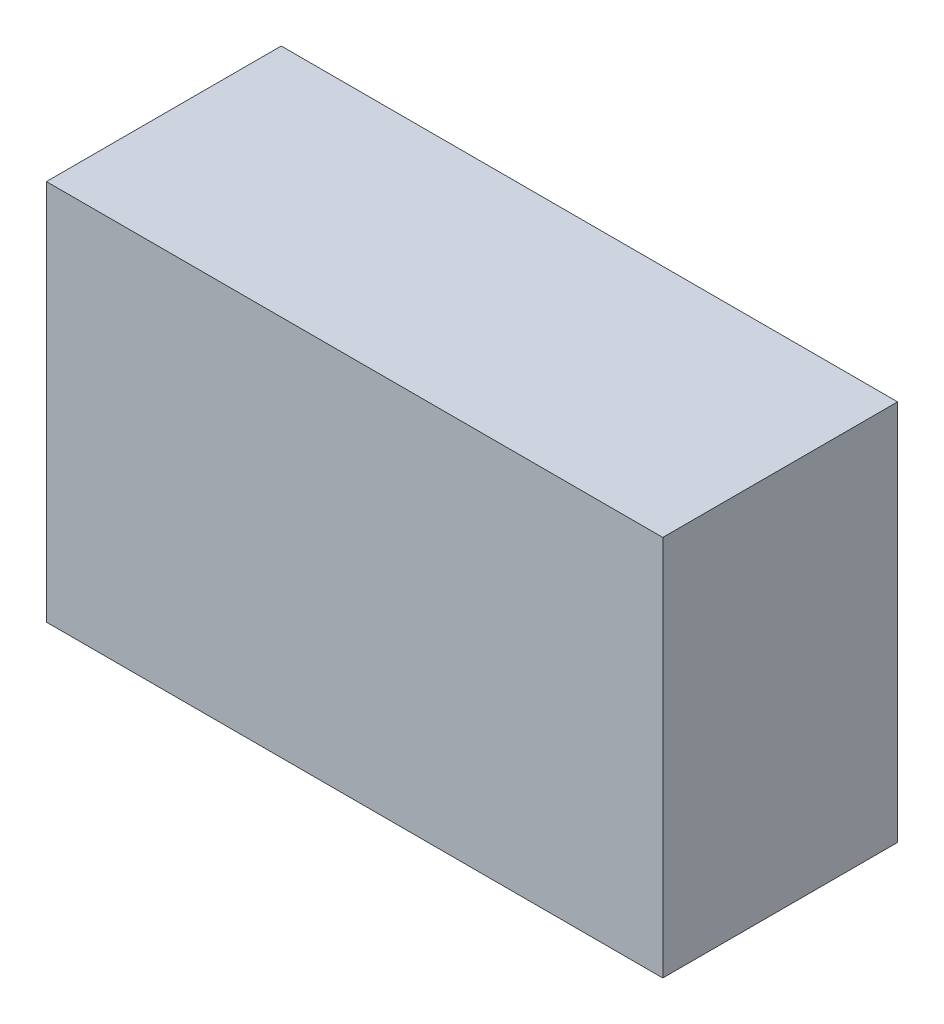
from build123d import *

# Parameters (mm, degrees)
SKETCH1_W           = 105
SKETCH1_H           = 40
BOSS_EXTRUDE1_DEPTH = 65


with BuildPart() as part:
    # Sketch1 → Boss-Extrude1 (new body)
    with BuildSketch(Plane(origin=(0, 0, 0), x_dir=(1, 0, 0), z_dir=(0, 1, 0))):
        Rectangle(SKETCH1_W, SKETCH1_H)
    extrude(amount=BOSS_EXTRUDE1_DEPTH)


solid = part.part
